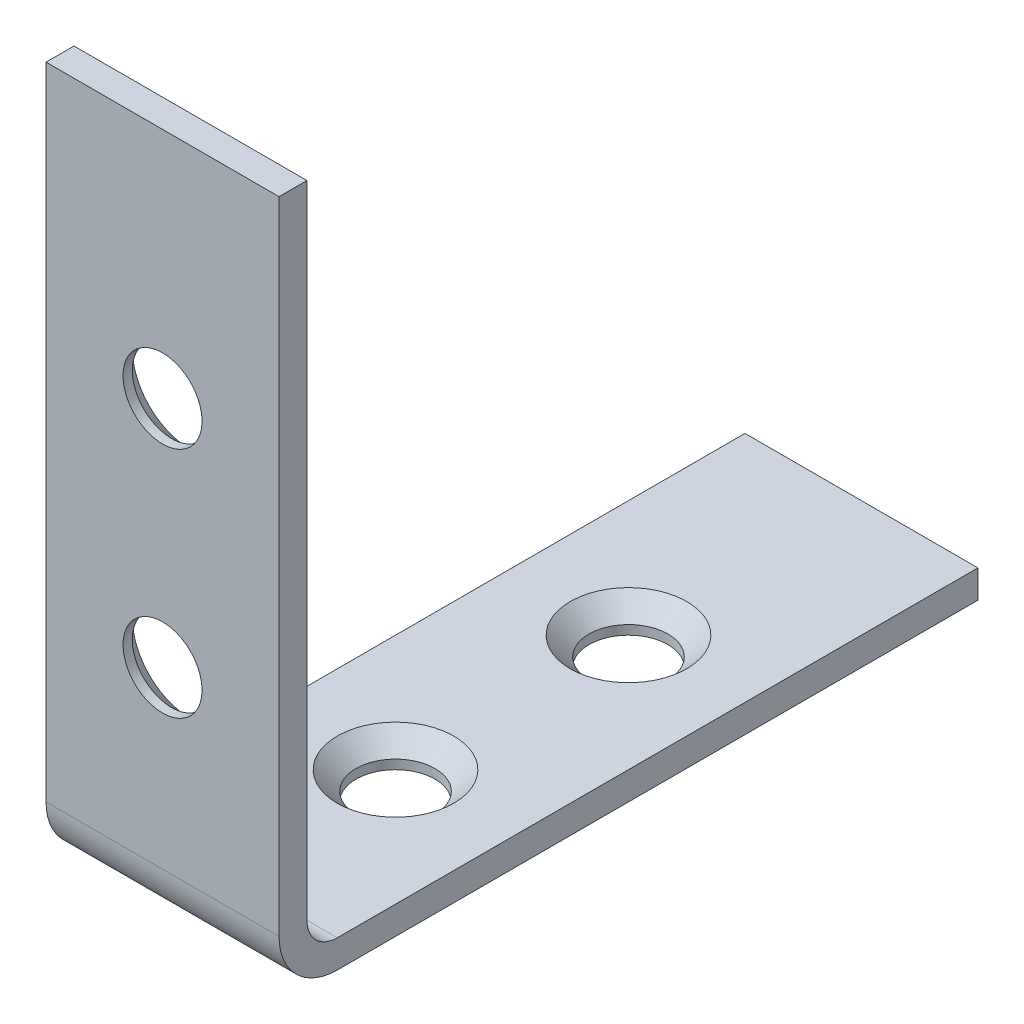
from build123d import *

# Parameters (mm, degrees)
BOSS_EXTRUDE1_DEPTH            = 6.35
F_6_CLEARANCE_HOLE1_AT_2_COUNT = 2
F_6_CLEARANCE_HOLE1_AT_2_PITCH = 12.7
F_6_CLEARANCE_HOLE2_AT_2_COUNT = 2
F_6_CLEARANCE_HOLE2_AT_2_PITCH = 12.7


with BuildPart() as part:
    # Sketch1 → Boss-Extrude1 (new, symmetric)
    with BuildSketch(Plane(origin=(0, 0, 0), x_dir=(0, 0, -1), z_dir=(1, 0, 0))):
        with BuildLine():
            Line((0, 3.175), (0, 38.1))
            Line((0, 38.1), (1.524, 38.1))
            Line((1.524, 38.1), (1.524, 3.175))
            ThreePointArc((1.524, 3.175), (2.007566704, 2.007566704), (3.175, 1.524))
            Line((3.175, 1.524), (38.1, 1.524))
            Line((38.1, 1.524), (38.1, 0))
            Line((38.1, 0), (3.175, 0))
            ThreePointArc((3.175, 0), (0.92993597, 0.92993597), (0, 3.175))
        make_face()
    extrude(amount=BOSS_EXTRUDE1_DEPTH, both=True)

    # Sketch3 → #6 Clearance Hole1 (revolve, cut)
    with BuildSketch(Plane(origin=(0, 1.524, -25.4), x_dir=(0, 0, 1), z_dir=(1, 0, 0))):
        Polygon((0, 0), (0, 1.524), (2.15265, 1.524), (2.15265, 1.02235), (3.175, 0), align=None)
    f_6_clearance_hole1 = revolve(axis=Axis((0, 7.874, -25.4), (0, -1, 0)), mode=Mode.SUBTRACT)

    # #6 Clearance Hole1 at 2: #6 Clearance Hole1 ×2
    with Locations(*[(0, 0, i * F_6_CLEARANCE_HOLE1_AT_2_PITCH) for i in range(1, F_6_CLEARANCE_HOLE1_AT_2_COUNT)]):
        add(f_6_clearance_hole1, mode=Mode.SUBTRACT)

    # Sketch6 → #6 Clearance Hole2 (revolve, cut)
    with BuildSketch(Plane(origin=(0, 12.7, -1.524), x_dir=(0, 1, 0), z_dir=(1, 0, 0))):
        Polygon((0, 0), (0, 1.524), (2.15265, 1.524), (2.15265, 1.02235), (3.175, 0), align=None)
    f_6_clearance_hole2 = revolve(axis=Axis((0, 12.7, -7.874), (0, 0, 1)), mode=Mode.SUBTRACT)

    # #6 Clearance Hole2 at 2: #6 Clearance Hole2 ×2
    with Locations(*[(0, i * F_6_CLEARANCE_HOLE2_AT_2_PITCH, 0) for i in range(1, F_6_CLEARANCE_HOLE2_AT_2_COUNT)]):
        add(f_6_clearance_hole2, mode=Mode.SUBTRACT)


solid = part.part
